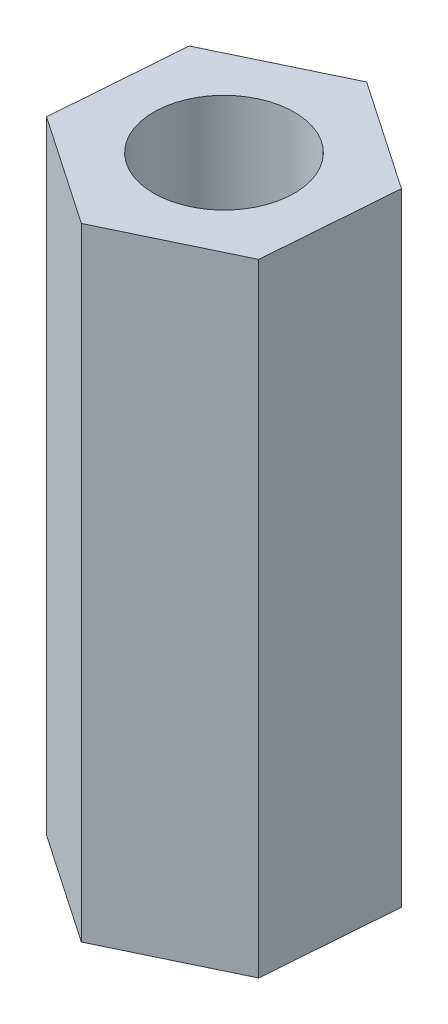
from build123d import *

# Parameters (mm, degrees)
BOSS_EXTRUDE1_DEPTH = 12.7
SKETCH2_R           = 1.435
CUT_EXTRUDE1_DEPTH  = 14.213432391


with BuildPart() as part:
    # Sketch1 → Boss-Extrude1 (new body)
    with BuildSketch(Plane(origin=(0, 0, 0), x_dir=(1, 0, 0), z_dir=(0, 1, 0))):
        Polygon((2.446196502, 1.174502451), (0.205949291, 2.705719539), (-2.240247211, 1.531217087), (-2.446196502, -1.174502451), (-0.205949291, -2.705719539), (2.240247211, -1.531217087), align=None)
    extrude(amount=BOSS_EXTRUDE1_DEPTH)

    # Sketch2 → Cut-Extrude1 (cut, through all)
    with BuildSketch(Plane(origin=(0, 12.7, 0), x_dir=(1, 0, 0), z_dir=(0, 1, 0))):
        with Locations(Location((0, 0, 0), (0, 0, 270))):
            Circle(SKETCH2_R)
    extrude(amount=-CUT_EXTRUDE1_DEPTH, mode=Mode.SUBTRACT)


solid = part.part
